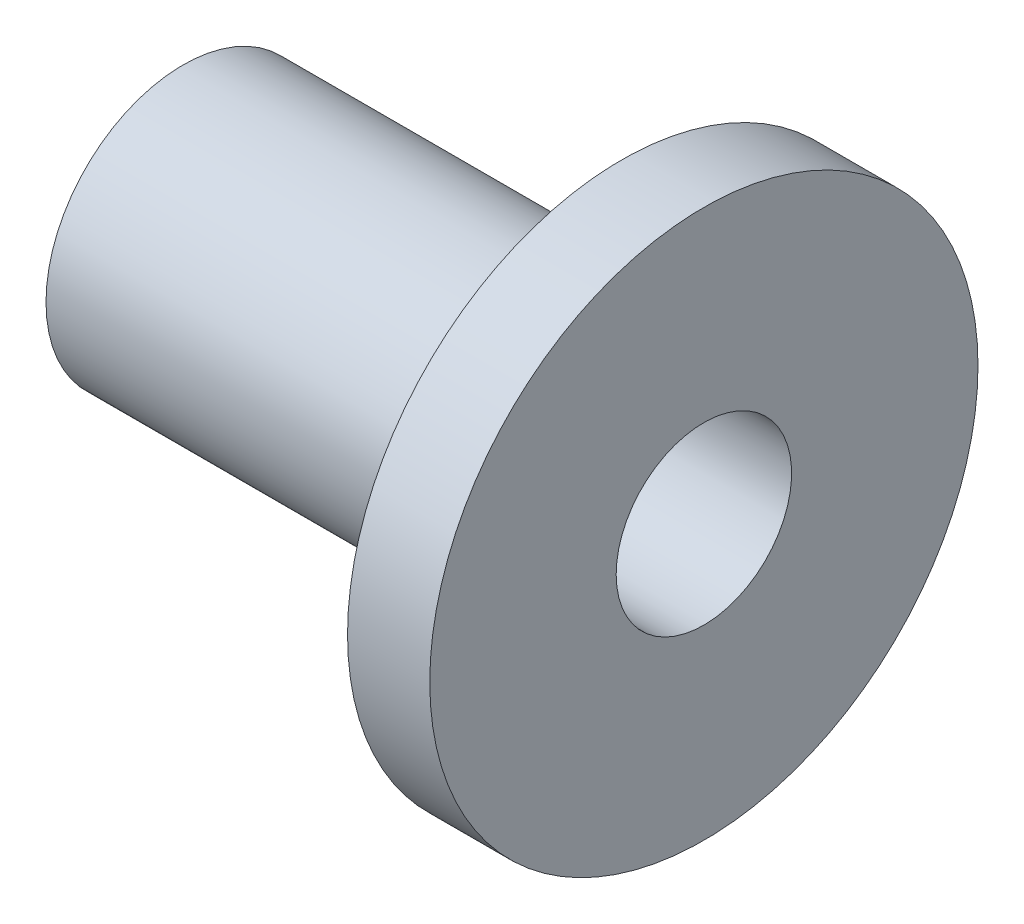
from build123d import *


with BuildPart() as part:
    # 草图1 → 旋转1 (revolve)
    with BuildSketch(Plane.XY, mode=Mode.PRIVATE) as revolve_1_sk:
        Polygon((0, 1.6), (0, 2.5), (8, 2.5), (8, 5), (9.5, 5), (9.5, 1.6), align=None)
    revolve(revolve_1_sk.sketch.rotate(Axis((0, 0, 0), (1, 0, 0)), 90), axis=Axis((0, 0, 0), (1, 0, 0)))


solid = part.part
